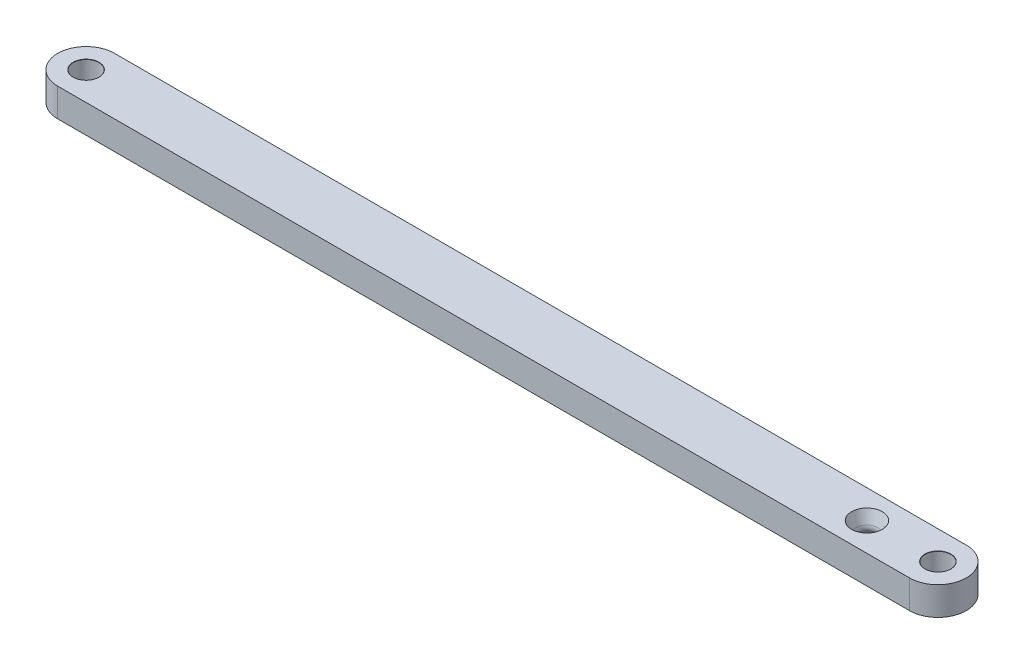
from build123d import *

# Parameters (mm, degrees)
SKETCH1_R                      = 1
BOSS_EXTRUDE1_DEPTH            = 2
M3_CLEARANCE_HOLE1_D           = 3.6
M3_CLEARANCE_HOLE1_CSINK_D     = 3.65
M3_CLEARANCE_HOLE1_CSINK_ANGLE = 90


with BuildPart() as part:
    # Sketch1 → Boss-Extrude1 (new, symmetric)
    with BuildSketch(Plane(origin=(0, 0, 0), x_dir=(1, 0, 0), z_dir=(0, 1, 0))):
        with BuildLine():
            Line((0, 4), (120, 4))
            ThreePointArc((120, 4), (124, 0), (120, -4))
            Line((120, -4), (0, -4))
            ThreePointArc((0, -4), (-4, 0), (0, 4))
        make_face()
        Circle(SKETCH1_R, mode=Mode.SUBTRACT)
        with Locations((120, 0)):
            Circle(SKETCH1_R, mode=Mode.SUBTRACT)
        with Locations((110, 0)):
            Circle(SKETCH1_R, mode=Mode.SUBTRACT)
    extrude(amount=BOSS_EXTRUDE1_DEPTH, both=True)

    # Sketch3 → Cut-Revolve1 (revolve, cut)
    with BuildSketch(Plane.XY):
        with BuildLine():
            Line((110, 2), (112.163762696, 2))
            Line((112.163762696, 2), (111.560307379, 0.342020143))
            ThreePointArc((111.560307379, 0.342020143), (111.5, 0), (111.560307379, -0.342020143))
            Line((111.560307379, -0.342020143), (112.163762696, -2))
            Line((112.163762696, -2), (110, -2))
            Line((110, -2), (110, 2))
        make_face()
    revolve(axis=Axis((110, 2, 0), (0, -1, 0)), mode=Mode.SUBTRACT)

    # M3 Clearance Hole1 (through all)
    with Locations(Plane(origin=(0, 2, 0), x_dir=(1, 0, 0), z_dir=(0, 1, 0))):
        with Locations((0, 0), (120, 0)):
            CounterSinkHole(M3_CLEARANCE_HOLE1_D / 2, M3_CLEARANCE_HOLE1_CSINK_D / 2, counter_sink_angle=M3_CLEARANCE_HOLE1_CSINK_ANGLE)


solid = part.part
